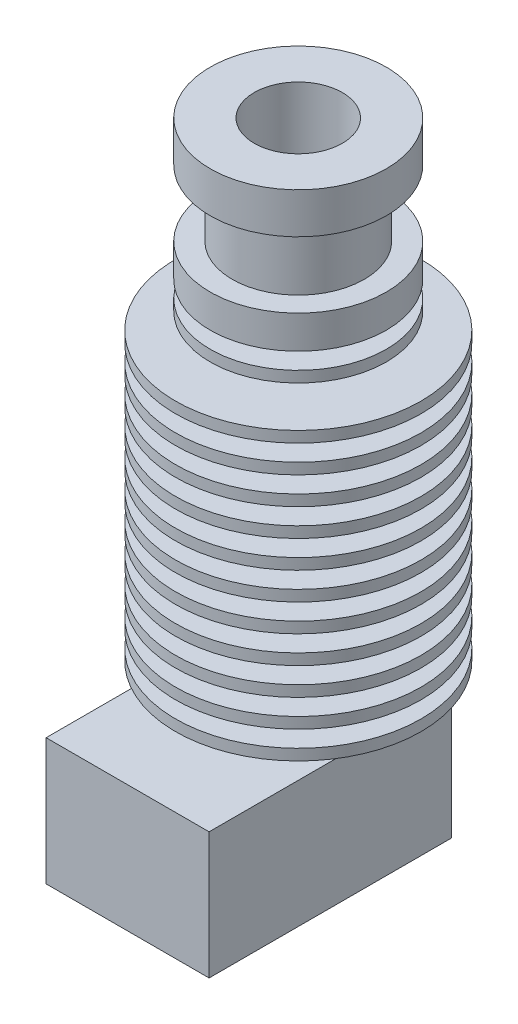
from build123d import *

# Parameters (mm, degrees)
SKETCH2_R           = 4
CUT_EXTRUDE1_DEPTH  = 6.5
SKETCH3_W           = 14.803302618
SKETCH3_H           = 22
BOSS_EXTRUDE1_DEPTH = 11.5
BOSS_EXTRUDE2_DEPTH = 2


with BuildPart() as part:
    # Sketch1 → Revolve1 (revolve)
    with BuildSketch(Plane.XY, mode=Mode.PRIVATE) as revolve1_sk:
        Polygon((0, 20.572271817), (-8, 20.572271817), (-8, 16.872271817), (-6, 16.872271817), (-6, 10.872271817), (-8, 10.872271817), (-8, 7.872271817), (-5.267364971, 7.872271817), (-5.267364971, 6.372271817), (-8, 6.372271817), (-8, 5.372271817), (-5.001966623, 5.372271817), (-5.001966623, 3.872271817), (-11.15, 3.872271817), (-11.15, 2.872271817), (-5.001966623, 2.872271817), (-5.001966623, 1.372271817), (-11.15, 1.372271817), (-11.15, 0.372271817), (-5.001966623, 0.372271817), (-5.001966623, -1.127728183), (-11.15, -1.127728183), (-11.15, -2.127728183), (-5.001966623, -2.127728183), (-5.001966623, -3.627728183), (-11.15, -3.627728183), (-11.15, -4.627728183), (-5.001966623, -4.627728183), (-5.001966623, -6.127728183), (-11.15, -6.127728183), (-11.15, -7.127728183), (-5.001966623, -7.127728183), (-5.001966623, -8.627728183), (-11.15, -8.627728183), (-11.15, -9.627728183), (-5.001966623, -9.627728183), (-5.001966623, -11.127728183), (-11.15, -11.127728183), (-11.15, -12.127728183), (-5.001966623, -12.127728183), (-5.001966623, -13.627728183), (-11.15, -13.627728183), (-11.15, -14.627728183), (-5.001966623, -14.627728183), (-5.001966623, -16.127728183), (-11.15, -16.127728183), (-11.15, -17.127728183), (-5.001966623, -17.127728183), (-5.001966623, -18.627728183), (-11.15, -18.627728183), (-11.15, -19.627728183), (-5.001966623, -19.627728183), (-5.001966623, -21.127728183), (-11.15, -21.127728183), (-11.15, -22.127728183), (-5.001966623, -22.127728183), (-3, -22.127728183), (-3, -39.714128425), (-0.738340975, -41.627728183), (0, -41.627728183), (0, -33.805569091), align=None)
    revolve(revolve1_sk.sketch.rotate(Axis((0, 0, 0), (0, 1, 0)), 180), axis=Axis((0, 0, 0), (0, 1, 0)))

    # Sketch2 → Cut-Extrude1 (cut)
    with BuildSketch(Plane(origin=(0, 20.572271817, 0), x_dir=(1, 0, 0), z_dir=(0, 1, 0))):
        with Locations(Location((0, 0, 0), (0, 0, 180))):
            Circle(SKETCH2_R)
    extrude(amount=-CUT_EXTRUDE1_DEPTH, mode=Mode.SUBTRACT)

    # Sketch3 → Boss-Extrude1 (add)
    with BuildSketch(Plane(origin=(0, -24.127728183, 0), x_dir=(-1, 0, 0), z_dir=(0, -1, 0))):
        with Locations((0, -4.5)):
            Rectangle(SKETCH3_W, SKETCH3_H)
    extrude(amount=BOSS_EXTRUDE1_DEPTH)

    # Sketch4 → Boss-Extrude2 (add)
    with BuildSketch(Plane(origin=(0, -35.627728183, 0), x_dir=(-1, 0, 0), z_dir=(0, -1, 0))):
        Polygon((4.730605377, 0), (2.365302689, 4.096824432), (-2.365302689, 4.096824432), (-4.730605377, 0), (-2.365302689, -4.096824432), (2.365302689, -4.096824432), align=None)
    extrude(amount=BOSS_EXTRUDE2_DEPTH)


solid = part.part
